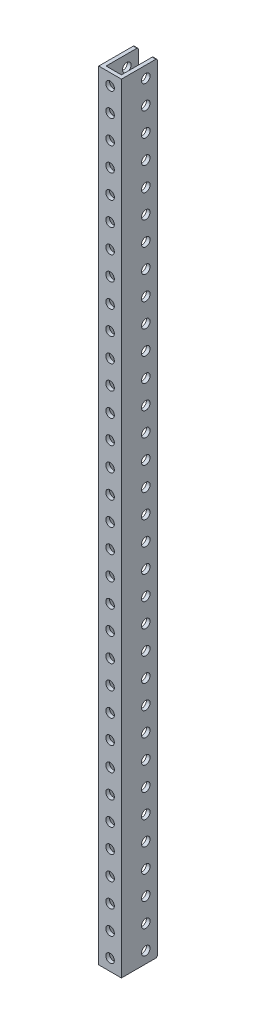
from build123d import *

# Parameters (mm, degrees)
SKETCH1_W                 = 322.453
SKETCH1_H                 = 14.859
BOSS_EXTRUDE1_DEPTH       = 9.398
SKETCH2_W                 = 6.35
SKETCH2_H                 = 13.335
CUT_EXTRUDE1_DEPTH        = 323.762823192
F_5_CLEARANCE_HOLE1_D     = 3.556
F_5_CLEARANCE_HOLE1_DEPTH = 1.524
F_5_CLEARANCE_HOLE2_D     = 3.556
F_5_CLEARANCE_HOLE2_DEPTH = 14.859
F_5_CLEARANCE_HOLE3_D     = 3.556
FILLET1_R                 = 0.635


with BuildPart() as part:
    # Sketch1 → Boss-Extrude1 (new body)
    with BuildSketch(Plane(origin=(-4.699, 0, 0), x_dir=(0, -1, 0), z_dir=(-1, 0, 0))):
        with Locations((-161.2265, -5.9055)):
            Rectangle(SKETCH1_W, SKETCH1_H)
    extrude(amount=-BOSS_EXTRUDE1_DEPTH)

    # Sketch2 → Cut-Extrude1 (cut, through all)
    with BuildSketch(Plane.XZ):
        with Locations((0, -6.6675)):
            Rectangle(SKETCH2_W, SKETCH2_H)
    extrude(amount=-CUT_EXTRUDE1_DEPTH, mode=Mode.SUBTRACT)

    # #5 Clearance Hole1
    with Locations(Plane(origin=(4.699, 0, 0), x_dir=(0, 0, -1), z_dir=(1, 0, 0))):
        with Locations((8.5725, 307.9115), (8.5725, 317.6905), (8.5725, 298.1325), (8.5725, 288.3535), (8.5725, 278.5745), (8.5725, 268.7955), (8.5725, 259.0165), (8.5725, 249.2375), (8.5725, 239.4585), (8.5725, 229.6795), (8.5725, 219.9005), (8.5725, 210.1215), (8.5725, 200.3425), (8.5725, 190.5635), (8.5725, 180.7845), (8.5725, 171.0055), (8.5725, 161.2265), (8.5725, 151.4475), (8.5725, 141.6685), (8.5725, 131.8895), (8.5725, 122.1105), (8.5725, 112.3315), (8.5725, 102.5525), (8.5725, 92.7735), (8.5725, 82.9945), (8.5725, 73.2155), (8.5725, 63.4365), (8.5725, 53.6575), (8.5725, 43.8785), (8.5725, 34.0995), (8.5725, 24.3205), (8.5725, 14.5415), (8.5725, 4.7625)):
            Hole(F_5_CLEARANCE_HOLE1_D / 2, depth=F_5_CLEARANCE_HOLE1_DEPTH)

    # #5 Clearance Hole2
    with Locations(Plane.XY.offset(1.524)):
        with Locations((0, 307.9115), (0, 317.6905), (0, 298.1325), (0, 288.3535), (0, 278.5745), (0, 268.7955), (0, 259.0165), (0, 249.2375), (0, 239.4585), (0, 229.6795), (0, 219.9005), (0, 210.1215), (0, 200.3425), (0, 190.5635), (0, 180.7845), (0, 171.0055), (0, 161.2265), (0, 151.4475), (0, 141.6685), (0, 131.8895), (0, 122.1105), (0, 112.3315), (0, 102.5525), (0, 92.7735), (0, 82.9945), (0, 73.2155), (0, 63.4365), (0, 53.6575), (0, 43.8785), (0, 34.0995), (0, 24.3205), (0, 14.5415), (0, 4.7625)):
            Hole(F_5_CLEARANCE_HOLE2_D / 2, depth=F_5_CLEARANCE_HOLE2_DEPTH)

    # #5 Clearance Hole3 (through all)
    with Locations(Plane(origin=(-3.175, 0, 0), x_dir=(0, 0, -1), z_dir=(1, 0, 0))):
        with Locations((8.5725, 307.9115), (8.5725, 317.6905), (8.5725, 298.1325), (8.5725, 288.3535), (8.5725, 278.5745), (8.5725, 268.7955), (8.5725, 259.0165), (8.5725, 249.2375), (8.5725, 239.4585), (8.5725, 229.6795), (8.5725, 219.9005), (8.5725, 210.1215), (8.5725, 200.3425), (8.5725, 190.5635), (8.5725, 180.7845), (8.5725, 171.0055), (8.5725, 161.2265), (8.5725, 151.4475), (8.5725, 141.6685), (8.5725, 131.8895), (8.5725, 122.1105), (8.5725, 112.3315), (8.5725, 102.5525), (8.5725, 92.7735), (8.5725, 82.9945), (8.5725, 73.2155), (8.5725, 63.4365), (8.5725, 53.6575), (8.5725, 43.8785), (8.5725, 34.0995), (8.5725, 24.3205), (8.5725, 14.5415), (8.5725, 4.7625)):
            Hole(F_5_CLEARANCE_HOLE3_D / 2)

    # Fillet1
    fillet1_edges = [part.edges().sort_by_distance(p)[0] for p in [
        (-3.937, 322.453, -13.335),
        (-3.937, 0, -13.335),
        (3.937, 0, -13.335),
        (3.937, 322.453, -13.335),
    ]]
    fillet(fillet1_edges, radius=FILLET1_R)


solid = part.part
